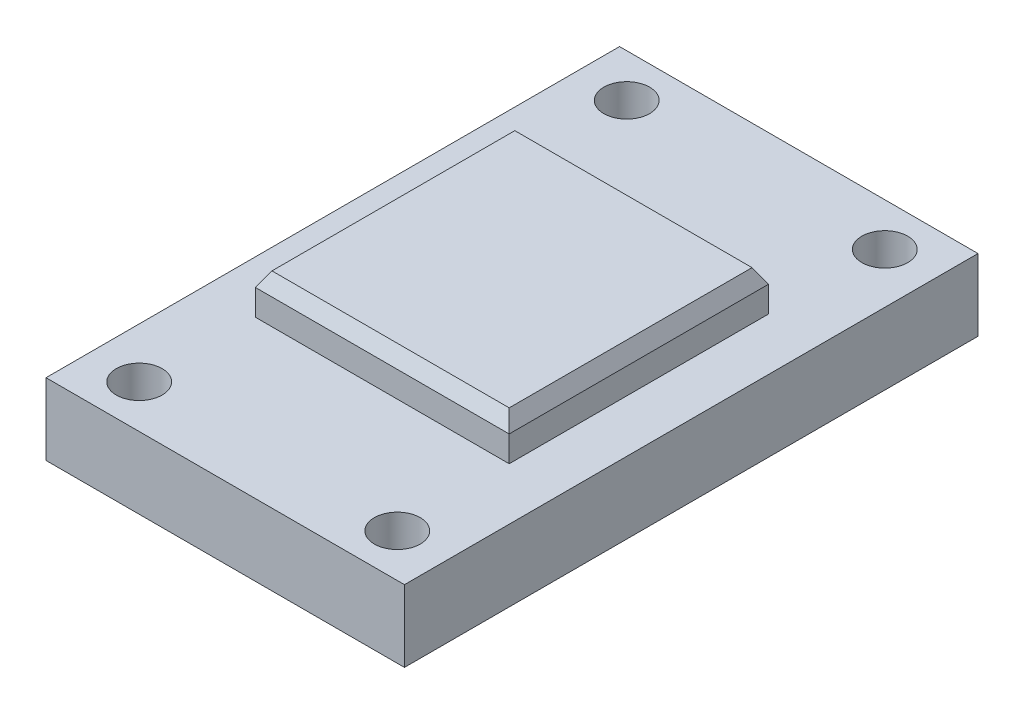
from build123d import *
from OCP.BRepFilletAPI import BRepFilletAPI_MakeChamfer

# Parameters (mm, degrees)
SKETCH1_W               = 25
SKETCH1_H               = 40
BOSS_EXTRUDE1_DEPTH     = 5
SKETCH4_R               = 4.15
CUT_EXTRUDE2_DEPTH      = 25.109126902
SKETCH9_W               = 17.7
SKETCH9_H               = 18.092678694
BOSS_EXTRUDE3_DEPTH     = 2.8
CUT_EXTRUDE4_DEPTH      = 25.109126902
CUT_EXTRUDE4_DEPTH_BACK = 25.109126902
SKETCH6_R               = 1.6
CHAMFER1_SIZE           = 1
CHAMFER1_SIZE2          = 0.577350269
SKETCH10_R              = 4.15
BOSS_EXTRUDE4_DEPTH     = 5


with BuildPart() as part:
    # Sketch1 → Boss-Extrude1 (new body)
    with BuildSketch(Plane(origin=(0, 0, 0), x_dir=(1, 0, 0), z_dir=(0, 1, 0))):
        Rectangle(SKETCH1_W, SKETCH1_H)
    extrude(amount=BOSS_EXTRUDE1_DEPTH)

    # Sketch4 → Cut-Extrude2 (cut, through all)
    with BuildSketch(Plane(origin=(0, 5, 0), x_dir=(1, 0, 0), z_dir=(0, 1, 0))):
        with Locations(Location((0, 0, 0), (0, 0, 270))):
            Circle(SKETCH4_R)
    extrude(amount=-CUT_EXTRUDE2_DEPTH, mode=Mode.SUBTRACT)

    # Sketch9 → Boss-Extrude3 (add)
    with BuildSketch(Plane(origin=(0, 5, 0), x_dir=(1, 0, 0), z_dir=(0, 1, 0))):
        Rectangle(SKETCH9_W, SKETCH9_H)
    extrude(amount=BOSS_EXTRUDE3_DEPTH)

    # Sketch6 → Cut-Extrude4 (cut, two sides: drawn at the far end of the back side and taken through both)
    with BuildSketch(Plane(origin=(0, 5, 0), x_dir=(1, 0, 0), z_dir=(0, 1, 0)).offset(-CUT_EXTRUDE4_DEPTH_BACK)):
        with Locations(Location((9, -17, 0), (0, 0, 270))):
            Circle(SKETCH6_R)
        with Locations(Location((-9, -17, 0), (0, 0, 270))):
            Circle(SKETCH6_R)
        with Locations(Location((-9, 17, 0), (0, 0, 270))):
            Circle(SKETCH6_R)
        with Locations(Location((9, 17, 0), (0, 0, 270))):
            Circle(SKETCH6_R)
    extrude(amount=CUT_EXTRUDE4_DEPTH + CUT_EXTRUDE4_DEPTH_BACK, mode=Mode.SUBTRACT)

    # Chamfer1: one chamfer whose edges measure the first distance from different faces: ONE call of the kernel's chamfer builder (chamfer() names one face for all edges)
    chamfer1_edges_1 = [part.edges().sort_by_distance(p)[0] for p in [
        (-8.85, 7.8, 0),
    ]]
    chamfer1_side_1 = [part.faces().sort_by_distance(p)[0] for p in [
        (-8.85, 6.4, 0),
    ]]
    chamfer1_edges_2 = [part.edges().sort_by_distance(p)[0] for p in [
        (0, 7.8, 9.046339347),
    ]]
    chamfer1_side_2 = [part.faces().sort_by_distance(p)[0] for p in [
        (0, 6.4, 9.046339347),
    ]]
    chamfer1_edges_3 = [part.edges().sort_by_distance(p)[0] for p in [
        (8.85, 7.8, 0),
    ]]
    chamfer1_side_3 = [part.faces().sort_by_distance(p)[0] for p in [
        (8.85, 6.4, 0),
    ]]
    chamfer1_edges_4 = [part.edges().sort_by_distance(p)[0] for p in [
        (0, 7.8, -9.046339347),
    ]]
    chamfer1_side_4 = [part.faces().sort_by_distance(p)[0] for p in [
        (0, 6.4, -9.046339347),
    ]]
    chamfer1 = BRepFilletAPI_MakeChamfer(part.part.solid().wrapped)
    for e in chamfer1_edges_1:
        chamfer1.Add(CHAMFER1_SIZE, CHAMFER1_SIZE2, e.wrapped, chamfer1_side_1[0].wrapped)  # the first distance lies on this face
    for e in chamfer1_edges_2:
        chamfer1.Add(CHAMFER1_SIZE, CHAMFER1_SIZE2, e.wrapped, chamfer1_side_2[0].wrapped)  # the first distance lies on this face
    for e in chamfer1_edges_3:
        chamfer1.Add(CHAMFER1_SIZE, CHAMFER1_SIZE2, e.wrapped, chamfer1_side_3[0].wrapped)  # the first distance lies on this face
    for e in chamfer1_edges_4:
        chamfer1.Add(CHAMFER1_SIZE, CHAMFER1_SIZE2, e.wrapped, chamfer1_side_4[0].wrapped)  # the first distance lies on this face
    add(Compound.cast(chamfer1.Shape()), mode=Mode.REPLACE)

    # Sketch10 → Boss-Extrude4 (add)
    with BuildSketch(Plane.XZ.offset(-5)):
        Circle(SKETCH10_R)
    extrude(amount=BOSS_EXTRUDE4_DEPTH)


solid = part.part
